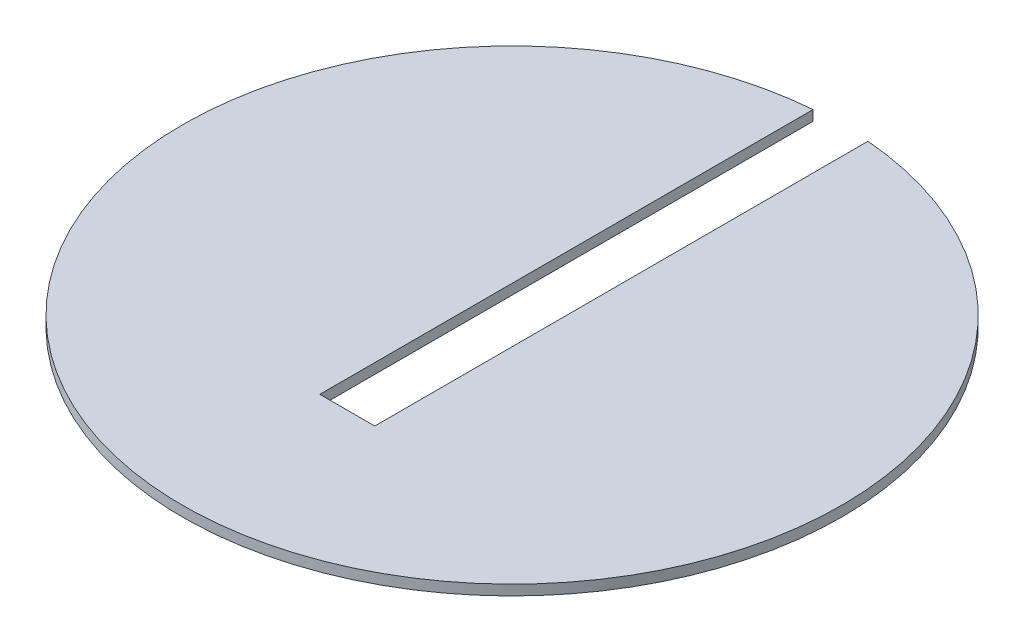
from build123d import *

# Parameters (mm, degrees)
Y_KSEKLIK_EKSTR_ZYON1_DEPTH = 2.8


with BuildPart() as part:
    # Çizim1 → Yükseklik-Ekstrüzyon1 (new body)
    with BuildSketch(Plane(origin=(0, 0, 0), x_dir=(1, 0, 0), z_dir=(0, 1, 0))):
        with BuildLine():
            Line((-7.5, -45), (7.5, -45))
            Line((7.5, -45), (7.5, 89.686955573))
            ThreePointArc((7.5, 89.686955573), (0, -90), (-7.5, 89.686955573))
            Line((-7.5, 89.686955573), (-7.5, -45))
        make_face()
    extrude(amount=Y_KSEKLIK_EKSTR_ZYON1_DEPTH)


solid = part.part
